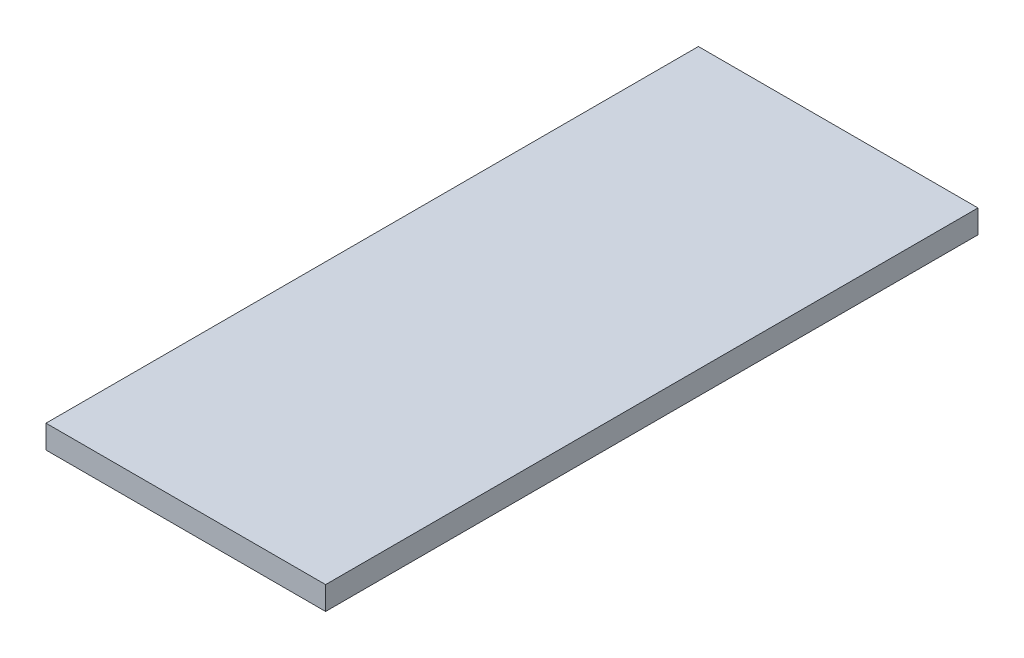
from build123d import *

# Parameters (mm, degrees)
SKETCH1_W           = 300
SKETCH1_H           = 700
BOSS_EXTRUDE1_DEPTH = 25


with BuildPart() as part:
    # Sketch1 → Boss-Extrude1 (new body)
    with BuildSketch(Plane(origin=(0, 0, 0), x_dir=(1, 0, 0), z_dir=(0, 1, 0))):
        with Locations((150, 350)):
            Rectangle(SKETCH1_W, SKETCH1_H)
    extrude(amount=BOSS_EXTRUDE1_DEPTH)


solid = part.part
